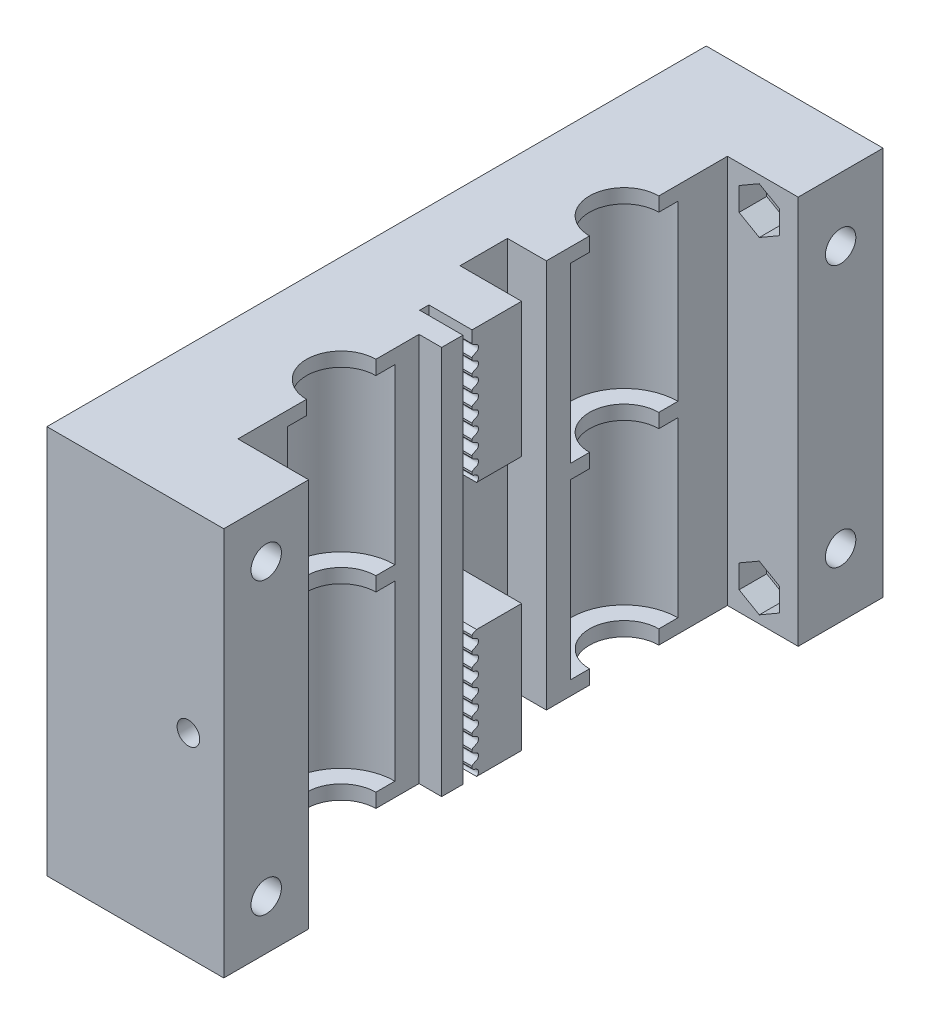
from build123d import *

# Parameters (mm, degrees)
BOSS_EXTRUDE1_DEPTH  = 55
BOSS_EXTRUDE2_DEPTH  = 2
BOSS_EXTRUDE3_DEPTH  = 2
BOSS_EXTRUDE4_DEPTH  = 2
SKETCH7_W            = 3.2
SKETCH7_H            = 2
BOSS_EXTRUDE5_DEPTH  = 55
SKETCH8_W            = 8.7
SKETCH8_H            = 3
SKETCH8_H_2          = 7
BOSS_EXTRUDE6_DEPTH  = 55
CUT_EXTRUDE4_DEPTH   = 8.7
LPATTERN1_COUNT      = 24
LPATTERN1_PITCH      = 2
LPATTERN1_COL_COUNT  = 4
LPATTERN1_COL_PITCH  = 2
SKETCH12_W           = 7
SKETCH12_H           = 18
CUT_EXTRUDE5_DEPTH   = 8.7
BOSS_EXTRUDE16_REACH = 81.633
SKETCH13_W           = 2.594079443
SKETCH13_H           = 4.169020651
SKETCH14_W           = 3.2
SKETCH14_H           = 2
CUT_EXTRUDE6_DEPTH   = 55
SKETCH16_W           = 4.169020651
SKETCH16_H           = 18
CUT_EXTRUDE7_DEPTH   = 2.594079443
SKETCH17_R           = 2.15
CUT_EXTRUDE8_DEPTH   = 25
SKETCH20_R           = 2.7
CUT_EXTRUDE9_DEPTH   = 9.5
CUT_EXTRUDE10_DEPTH  = 3.9
SKETCH23_R           = 1.6
CUT_EXTRUDE11_DEPTH  = 8.1
CUT_EXTRUDE12_DEPTH  = 4
SKETCH27_R           = 1.6
CUT_EXTRUDE13_DEPTH  = 8
CUT_EXTRUDE14_DEPTH  = 4
LPATTERN4_COUNT      = 2
LPATTERN4_PITCH      = 37
CUT_EXTRUDE15_DEPTH  = 4
LPATTERN5_COUNT      = 2
LPATTERN5_PITCH      = 41


with BuildPart() as part:
    # Sketch1 → Boss-Extrude1 (new body)
    with BuildSketch(Plane(origin=(0, 0, 0), x_dir=(1, 0, 0), z_dir=(0, 1, 0))):
        with BuildLine():
            Line((0, 36.6), (0, 43.6))
            Line((0, 43.6), (10, 43.6))
            Line((10, 43.6), (10, 55.6))
            Line((10, 55.6), (-15, 55.6))
            Line((-15, 55.6), (-15, -37.6))
            Line((-15, -37.6), (10, -37.6))
            Line((10, -37.6), (10, -25.6))
            Line((10, -25.6), (0, -25.6))
            Line((0, -25.6), (0, -18.6))
            ThreePointArc((0, -18.6), (-7.6, -11), (0, -3.4))
            Line((0, -3.4), (0, 0))
            Line((0, 0), (-5.5, 0))
            Line((-5.5, 0), (-5.5, 18))
            Line((-5.5, 18), (0, 18))
            Line((0, 18), (0, 21.4))
            ThreePointArc((0, 21.4), (-7.6, 29), (0, 36.6))
        make_face()
    extrude(amount=BOSS_EXTRUDE1_DEPTH)

    # Sketch2 → Boss-Extrude2 (add)
    with BuildSketch(Plane.XZ):
        with BuildLine():
            Line((0, 18.6), (0, 15.9))
            ThreePointArc((0, 15.9), (-4.9, 11), (0, 6.1))
            Line((0, 6.1), (0, 3.4))
            ThreePointArc((0, 3.4), (-7.6, 11), (0, 18.6))
        make_face()
        with BuildLine():
            Line((0, -21.4), (0, -24.102006986))
            ThreePointArc((0, -24.102006986), (-4.897993014, -29), (0, -33.897993014))
            Line((0, -33.897993014), (0, -36.6))
            ThreePointArc((0, -36.6), (-7.6, -29), (0, -21.4))
        make_face()
    extrude(amount=-BOSS_EXTRUDE2_DEPTH)

    # Sketch3 → Boss-Extrude3 (add)
    with BuildSketch(Plane(origin=(0, 26.5, 0), x_dir=(-1, 0, 0), z_dir=(0, -1, 0))):
        with BuildLine():
            Line((0, -3.4), (0, -6.1))
            ThreePointArc((0, -6.1), (4.9, -11), (0, -15.9))
            Line((0, -15.9), (0, -18.6))
            ThreePointArc((0, -18.6), (7.6, -11), (0, -3.4))
        make_face()
        with BuildLine():
            Line((0, 21.4), (0, 24.1))
            ThreePointArc((0, 24.1), (4.9, 29), (0, 33.9))
            Line((0, 33.9), (0, 36.6))
            ThreePointArc((0, 36.6), (7.6, 29), (0, 21.4))
        make_face()
    extrude(amount=-BOSS_EXTRUDE3_DEPTH)

    # Sketch4 → Boss-Extrude4 (add)
    with BuildSketch(Plane(origin=(0, 53, 0), x_dir=(-1, 0, 0), z_dir=(0, -1, 0))):
        with BuildLine():
            Line((0, -18.6), (0, -15.9))
            ThreePointArc((0, -15.9), (4.9, -11), (0, -6.1))
            Line((0, -6.1), (0, -3.4))
            ThreePointArc((0, -3.4), (7.6, -11), (0, -18.6))
        make_face()
        with BuildLine():
            Line((0, 36.6), (0, 33.9))
            ThreePointArc((0, 33.9), (4.9, 29), (0, 24.1))
            Line((0, 24.1), (0, 21.4))
            ThreePointArc((0, 21.4), (7.6, 29), (0, 36.6))
        make_face()
    extrude(amount=-BOSS_EXTRUDE4_DEPTH)

    # Sketch7 → Boss-Extrude5 (add)
    with BuildSketch(Plane(origin=(0, 55, 0), x_dir=(1, 0, 0), z_dir=(0, 1, 0))):
        with Locations((1.6, -1)):
            Rectangle(SKETCH7_W, SKETCH7_H)
    extrude(amount=-BOSS_EXTRUDE5_DEPTH)

    # Sketch8 → Boss-Extrude6 (add)
    with BuildSketch(Plane(origin=(0, 55, 0), x_dir=(1, 0, 0), z_dir=(0, 1, 0))):
        with Locations((-1.15, 1.5)):
            Rectangle(SKETCH8_W, SKETCH8_H)
        with Locations((-1.15, 7.8)):
            Rectangle(SKETCH8_W, SKETCH8_H_2)
    extrude(amount=-BOSS_EXTRUDE6_DEPTH)

    # Sketch11 → Cut-Extrude4 (cut)
    with BuildSketch(Plane(origin=(3.2, 0, 0), x_dir=(0, 0, -1), z_dir=(1, 0, 0))):
        with BuildLine():
            Line((4.3, 47.306239619), (4.3, 45.569818597))
            add(Edge.make_bspline(
                [(4.3, 47.306239619), (4.304585671, 47.289689378), (4.3205234, 47.245302086), (4.371187464, 47.170773911), (4.477078697, 47.101170886), (4.604073268, 47.05438594), (4.721377885, 46.99713352), (4.825385829, 46.947432948), (4.924110578, 46.904687552), (5.018626137, 46.852511072), (5.108648129, 46.778296095), (5.15607818, 46.681619296), (5.190529888, 46.592603511), (5.191346872, 46.519529121), (5.193134848, 46.456137941), (5.189134979, 46.382933066), (5.187052273, 46.2870515), (5.139920256, 46.170937817), (5.049433419, 46.05704295), (4.908650786, 45.985589234), (4.755373788, 45.916019055), (4.621045426, 45.852918244), (4.507485633, 45.800421351), (4.412155305, 45.756237133), (4.335588319, 45.676206789), (4.308791101, 45.606289517), (4.3, 45.569818597)],
                knots=[0.051147154, 0.051147154, 0.051147154, 0.051147154, 0.068471507, 0.098589582, 0.140403267, 0.193950507, 0.235463377, 0.272242123, 0.31054318, 0.344117088, 0.381404375, 0.426159519, 0.451184085, 0.477134734, 0.499165141, 0.51543248, 0.551275289, 0.595352972, 0.639475819, 0.695379202, 0.75212591, 0.810504395, 0.845135106, 0.878871382, 0.916022594, 0.953547895, 0.953547895, 0.953547895, 0.953547895], degree=3))
        make_face()
    cut_extrude4 = extrude(amount=-CUT_EXTRUDE4_DEPTH, mode=Mode.SUBTRACT)

    # LPattern1: Cut-Extrude4 ×24
    with Locations(*[(0, -i * LPATTERN1_PITCH, 0) for i in range(1, LPATTERN1_COUNT)]):
        add(cut_extrude4, mode=Mode.SUBTRACT)

    # LPattern1 col: Cut-Extrude4 ×4
    with Locations(*[(0, i * LPATTERN1_COL_PITCH, 0) for i in range(1, LPATTERN1_COL_COUNT)]):
        add(cut_extrude4, mode=Mode.SUBTRACT)

    # Sketch12 → Cut-Extrude5 (cut)
    with BuildSketch(Plane(origin=(3.2, 0, 0), x_dir=(0, 0, -1), z_dir=(1, 0, 0))):
        with Locations((7.8, 27)):
            Rectangle(SKETCH12_W, SKETCH12_H)
    extrude(amount=-CUT_EXTRUDE5_DEPTH, mode=Mode.SUBTRACT)

    # Boss-Extrude16: up to this face of the body (flat: up to its plane)
    boss_extrude16_end = Plane(part.part.faces().sort_by_distance((-5.761900149, 0, -8.801487551))[0])
    # Sketch13 → Boss-Extrude16 (add, up to the picked face)
    with BuildSketch(Plane(origin=(0, 55, 0), x_dir=(1, 0, 0), z_dir=(0, 1, 0)), mode=Mode.PRIVATE) as boss_extrude16_sk1:
        with Locations((-4.202960278, 5.084510326)):
            Rectangle(SKETCH13_W, SKETCH13_H)
    boss_extrude16_tool1 = split(extrude(boss_extrude16_sk1.sketch, amount=-BOSS_EXTRUDE16_REACH, mode=Mode.PRIVATE), bisect_by=boss_extrude16_end, keep=Keep.BOTH, mode=Mode.PRIVATE)
    add(boss_extrude16_tool1.solids().sort_by(Axis((-4.20296, 55, -5.08451), (0, -1, 0)))[0])

    # Sketch14 → Cut-Extrude6 (cut)
    with BuildSketch(Plane(origin=(0, 55, 0), x_dir=(1, 0, 0), z_dir=(0, 1, 0))):
        with Locations((1.6, -1)):
            Rectangle(SKETCH14_W, SKETCH14_H)
    extrude(amount=-CUT_EXTRUDE6_DEPTH, mode=Mode.SUBTRACT)

    # Sketch16 → Cut-Extrude7 (cut)
    with BuildSketch(Plane(origin=(-2.905920557, 0, 0), x_dir=(0, 0, -1), z_dir=(1, 0, 0))):
        with Locations((5.084510326, 27)):
            Rectangle(SKETCH16_W, SKETCH16_H)
    extrude(amount=-CUT_EXTRUDE7_DEPTH, mode=Mode.SUBTRACT)

    # Sketch17 → Cut-Extrude8 (cut)
    with BuildSketch(Plane.ZY.offset(15)):
        with Locations((31.6, 48)):
            Circle(SKETCH17_R)
        with Locations((31.6, 7)):
            Circle(SKETCH17_R)
        with Locations((-49.6, 9)):
            Circle(SKETCH17_R)
        with Locations((-49.6, 46)):
            Circle(SKETCH17_R)
    extrude(amount=-CUT_EXTRUDE8_DEPTH, mode=Mode.SUBTRACT)

    # Sketch20 → Cut-Extrude9 (cut)
    with BuildSketch(Plane(origin=(-5.5, 0, 0), x_dir=(0, 0, -1), z_dir=(1, 0, 0))):
        with Locations((9, 27.5)):
            Circle(SKETCH20_R)
    extrude(amount=-CUT_EXTRUDE9_DEPTH, mode=Mode.SUBTRACT)

    # Sketch21 → Cut-Extrude10 (cut)
    with BuildSketch(Plane.XY.offset(-43.6)):
        Polygon((4.5, 47.309103466), (7.35, 48.954551733), (7.35, 52.245448267), (4.5, 53.890896534), (1.65, 52.245448267), (1.65, 48.954551733), align=None)
    cut_extrude10 = extrude(amount=-CUT_EXTRUDE10_DEPTH, mode=Mode.SUBTRACT)

    # Sketch23 → Cut-Extrude11 (cut)
    with BuildSketch(Plane.XY.offset(-47.5)):
        with Locations((4.5, 50.6)):
            Circle(SKETCH23_R)
    cut_extrude11 = extrude(amount=-CUT_EXTRUDE11_DEPTH, mode=Mode.SUBTRACT)

    # Mirror1: Cut-Extrude10, Cut-Extrude11 across plane
    add(cut_extrude10.mirror(Plane.ZX.offset(27.5)), mode=Mode.SUBTRACT)
    add(cut_extrude11.mirror(Plane.ZX.offset(27.5)), mode=Mode.SUBTRACT)

    # Sketch26 → Cut-Extrude12 (cut)
    with BuildSketch(Plane(origin=(0, 0, 25.6), x_dir=(-1, 0, 0), z_dir=(0, 0, -1))):
        Polygon((-5, 24.209103466), (-2.15, 25.854551733), (-2.15, 29.145448267), (-5, 30.790896534), (-7.85, 29.145448267), (-7.85, 25.854551733), align=None)
    extrude(amount=-CUT_EXTRUDE12_DEPTH, mode=Mode.SUBTRACT)

    # Sketch27 → Cut-Extrude13 (cut)
    with BuildSketch(Plane(origin=(0, 0, 29.6), x_dir=(-1, 0, 0), z_dir=(0, 0, -1))):
        with Locations((-5, 27.5)):
            Circle(SKETCH27_R)
    extrude(amount=-CUT_EXTRUDE13_DEPTH, mode=Mode.SUBTRACT)

    # Sketch28 → Cut-Extrude14 (cut)
    with BuildSketch(Plane.ZY.offset(15)):
        Polygon((-45.95, 11.107328483), (-49.6, 13.214656965), (-53.25, 11.107328483), (-53.25, 6.892671517), (-49.6, 4.785343035), (-45.95, 6.892671517), align=None)
    cut_extrude14 = extrude(amount=-CUT_EXTRUDE14_DEPTH, mode=Mode.SUBTRACT)

    # LPattern4: Cut-Extrude14 ×2
    with Locations(*[(0, i * LPATTERN4_PITCH, 0) for i in range(1, LPATTERN4_COUNT)]):
        add(cut_extrude14, mode=Mode.SUBTRACT)

    # Sketch29 → Cut-Extrude15 (cut)
    with BuildSketch(Plane.ZY.offset(15)):
        Polygon((31.6, 11.214656965), (27.95, 9.107328483), (27.95, 4.892671517), (31.6, 2.785343035), (35.25, 4.892671517), (35.25, 9.107328483), align=None)
    cut_extrude15 = extrude(amount=-CUT_EXTRUDE15_DEPTH, mode=Mode.SUBTRACT)

    # LPattern5: Cut-Extrude15 ×2
    with Locations(*[(0, i * LPATTERN5_PITCH, 0) for i in range(1, LPATTERN5_COUNT)]):
        add(cut_extrude15, mode=Mode.SUBTRACT)


solid = part.part
